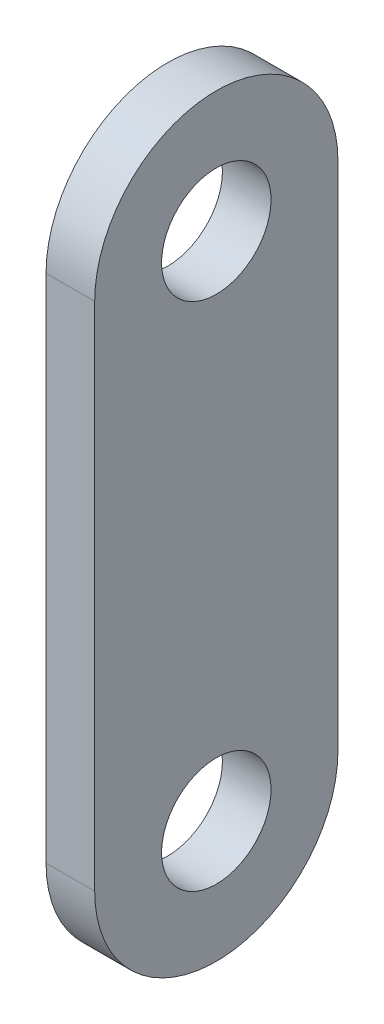
from build123d import *

# Parameters (mm, degrees)
SKETCH1_R           = 7.14375
BOSS_EXTRUDE1_DEPTH = 6.35


with BuildPart() as part:
    # Sketch1 → Boss-Extrude1 (new body)
    with BuildSketch(Plane(origin=(0, 0, 0), x_dir=(0, 0, -1), z_dir=(1, 0, 0))):
        with BuildLine():
            Line((15.875, 0), (15.875, -66.675))
            ThreePointArc((15.875, -66.675), (0, -82.55), (-15.875, -66.675))
            Line((-15.875, -66.675), (-15.875, 0))
            ThreePointArc((-15.875, 0), (0, 15.875), (15.875, 0))
        make_face()
        Circle(SKETCH1_R, mode=Mode.SUBTRACT)
        with Locations((0, -66.675)):
            Circle(SKETCH1_R, mode=Mode.SUBTRACT)
    extrude(amount=BOSS_EXTRUDE1_DEPTH)


solid = part.part
